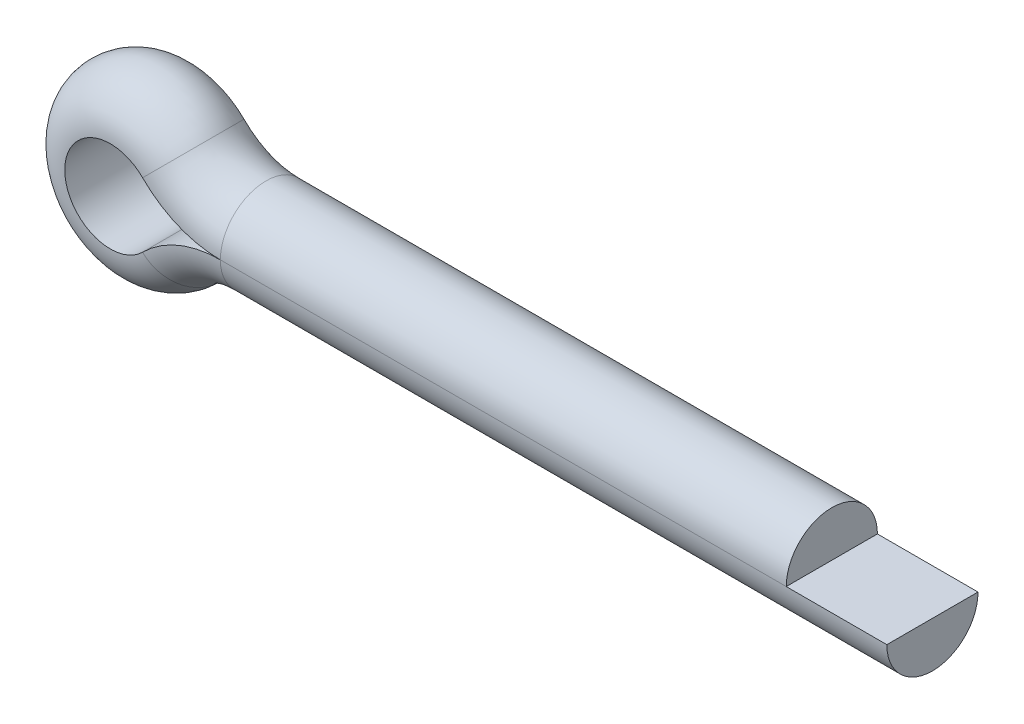
from build123d import *


with BuildPart() as part:
    # Body: sweep along a path in PathSke
    with BuildLine(Plane(origin=(1.207969362, 1.807969362, 0), x_dir=(0, 1, 0), z_dir=(0, 0, 1))) as body_path:
        Line((-0.357969362, -23.192030638), (-0.357969362, -5.192030638))
        ThreePointArc((-0.357969362, -5.192030638), (-0.201939729, -4.407742914), (0.242387718, -3.742892857))
        ThreePointArc((0.242387718, -3.742892857), (-1.807969362, 1.207969362), (-3.858326443, -3.742892857))
        ThreePointArc((-3.858326443, -3.742892857), (-3.413998995, -4.407742914), (-3.257969362, -5.192030638))
        Line((-3.257969362, -5.192030638), (-3.257969362, -26.392030638))
    # SectionSke → Body (sweep)
    with BuildSketch(Plane(origin=(24.4, 0.15, 0.15), x_dir=(0, 1, 0), z_dir=(1, 0, 0))):
        with BuildLine():
            Line((-0.15, -1.6), (-0.15, 1.3))
            ThreePointArc((-0.15, 1.3), (1.3, -0.15), (-0.15, -1.6))
        make_face()
    sweep(path=body_path.line)


solid = part.part
